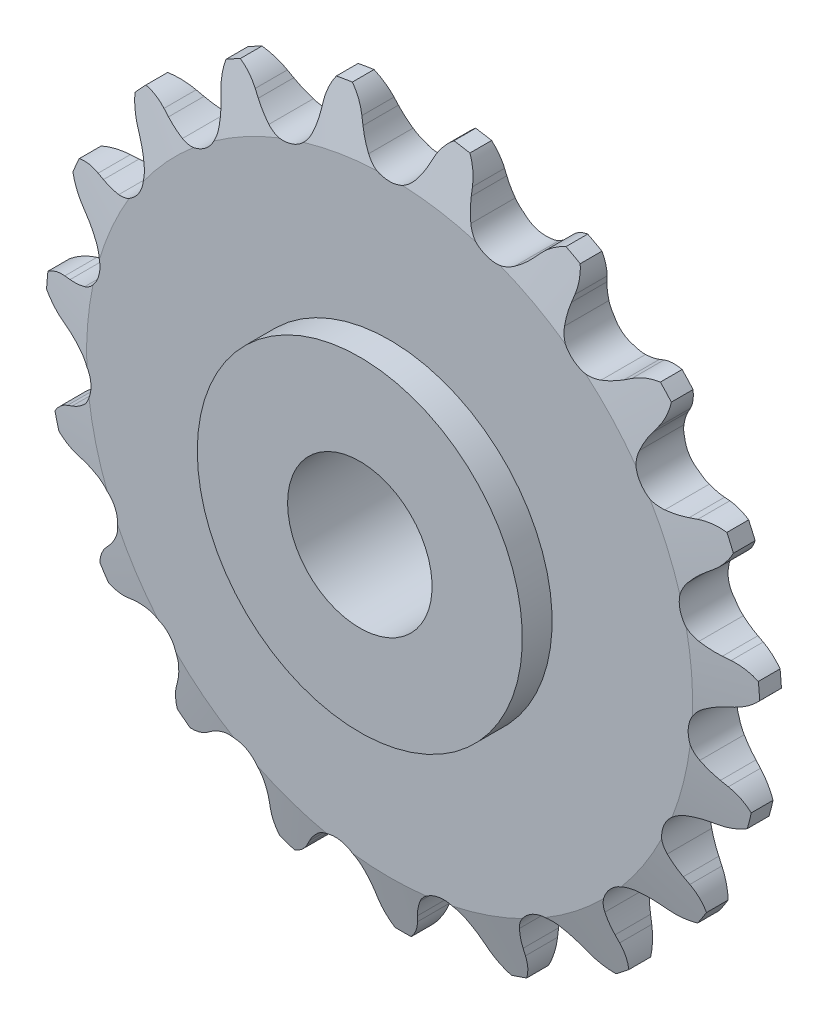
from build123d import *

# Parameters (mm, degrees)
CUT_EXTRUDE1_DEPTH      = 45.45475117
CIRPATTERN1_COUNT       = 19
SKETCH2_R               = 14.2875
BOSS_EXTRUDE1_DEPTH     = 4.7625
CUT_EXTRUDE2_DEPTH      = 45.617830833
CUT_EXTRUDE2_DEPTH_BACK = 45.617830833
SKETCH3_R               = 6.35


with BuildPart() as part:
    # Sketch1 → Revolve1 (revolve)
    with BuildSketch(Plane(origin=(0, 0, 0), x_dir=(0, 0, -1), z_dir=(1, 0, 0)), mode=Mode.PRIVATE) as revolve1_sk:
        Polygon((-2.1463, 0), (2.1463, 0), (2.1463, 26.635097821), (0.955675, 31.397597821), (-0.955675, 31.397597821), (-2.1463, 26.635097821), align=None)
    revolve(revolve1_sk.sketch.rotate(Axis((0, 0, 2.1463), (0, 0, -1)), 90), axis=Axis((0, 0, 2.1463), (0, 0, -1)))

    # Sketch0 → Cut-Extrude1 (cut, symmetric)
    with BuildSketch(Plane.XY):
        with BuildLine():
            Line((7.965678601, -28.48236685), (7.631458828, -27.959338647))
            ThreePointArc((7.631458828, -27.959338647), (7.11379474, -27.255708725), (6.508427893, -26.625945154))
            ThreePointArc((6.508427893, -26.625945154), (4.336068336, -25.984632956), (2.489646941, -27.296561086))
            ThreePointArc((2.489646941, -27.296561086), (2.121564437, -28.088764623), (1.860417079, -28.92235519))
            Line((1.860417079, -28.92235519), (1.714133235, -29.525565264))
            ThreePointArc((1.714133235, -29.525565264), (0.098295893, -31.930165139), (-2.69256545, -32.707419173))
            ThreePointArc((-2.69256545, -32.707419173), (5.401675429, -32.370466172), (13.166756472, -30.060966413))
            ThreePointArc((13.166756472, -30.060966413), (10.274737722, -30.232017343), (7.965678601, -28.48236685))
        make_face()
    cut_extrude1 = extrude(amount=CUT_EXTRUDE1_DEPTH, both=True, mode=Mode.SUBTRACT)

    # CirPattern1: Cut-Extrude1 ×19 about axis
    cirpattern1_axis = Axis((0, 0, 0), (0, 0, 1))
    for i in range(1, CIRPATTERN1_COUNT):
        add(cut_extrude1.rotate(cirpattern1_axis, i * 360 / CIRPATTERN1_COUNT), mode=Mode.SUBTRACT)

    # Sketch2 → Boss-Extrude1 (add, symmetric)
    with BuildSketch(Plane.XY):
        with Locations(Location((0, 0, 0), (0, 0, 180))):
            Circle(SKETCH2_R)
    extrude(amount=BOSS_EXTRUDE1_DEPTH, both=True)

    # Sketch3 → Cut-Extrude2 (cut, two sides: drawn at the far end of the back side and taken through both)
    with BuildSketch(Plane.XY.offset(-CUT_EXTRUDE2_DEPTH_BACK)):
        with Locations(Location((0, 0, 0), (0, 0, 180))):
            Circle(SKETCH3_R)
    extrude(amount=CUT_EXTRUDE2_DEPTH + CUT_EXTRUDE2_DEPTH_BACK, mode=Mode.SUBTRACT)


solid = part.part
